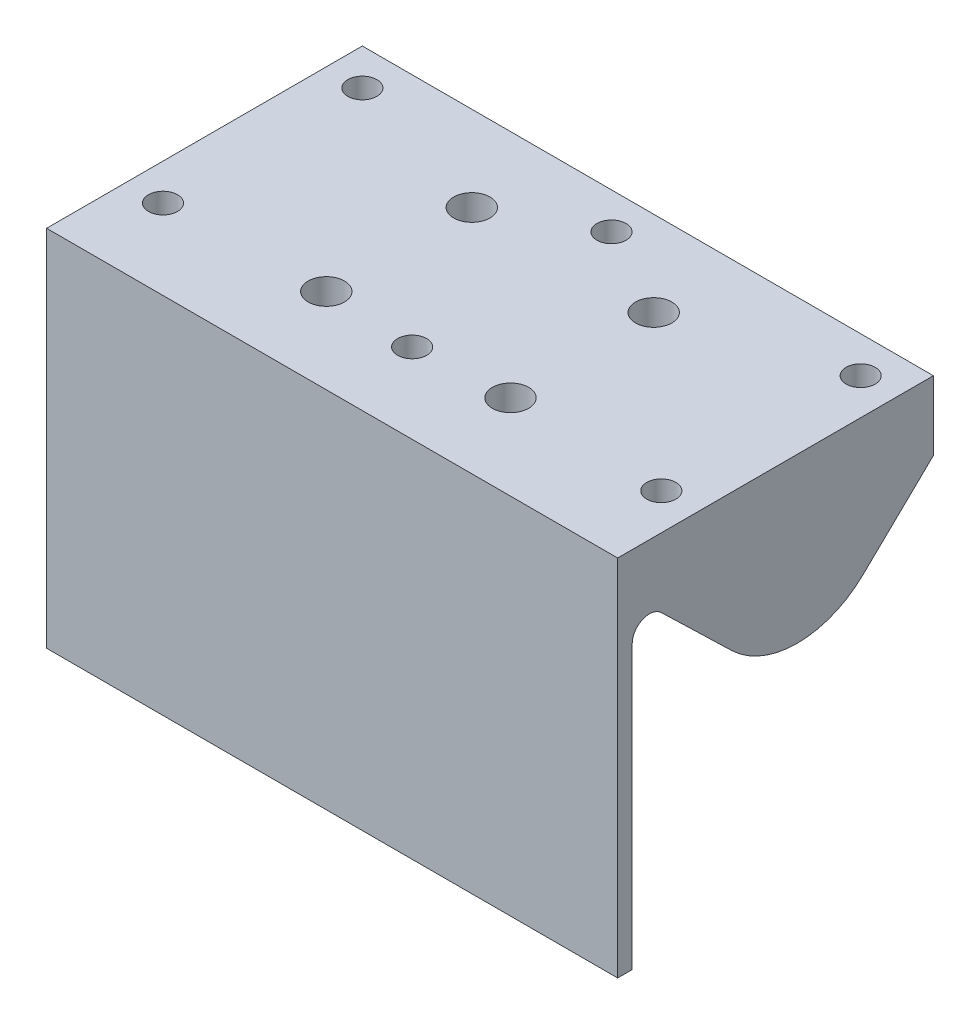
from build123d import *

# Parameters (mm, degrees)
SKETCH1_W           = 78.5
SKETCH1_H           = 37.4
BOSS_EXTRUDE1_DEPTH = 9.5
SKETCH6_R           = 2
CUT_EXTRUDE1_DEPTH  = 6.5
BOSS_EXTRUDE2_DEPTH = 4
SKETCH9_W           = 13
SKETCH9_H           = 5.5
CUT_EXTRUDE3_DEPTH  = 56.75233179
BOSS_EXTRUDE3_REACH = 83.737
BOSS_EXTRUDE4_START = -4
BOSS_EXTRUDE4_DEPTH = 4
BOSS_EXTRUDE5_DEPTH = 4
SKETCH15_R          = 2.5
CUT_EXTRUDE4_DEPTH  = 15
SKETCH16_R          = 4
CUT_EXTRUDE5_DEPTH  = 3


with BuildPart() as part:
    # Sketch1 → Boss-Extrude1 (new body)
    with BuildSketch(Plane(origin=(0, 0, 0), x_dir=(1, 0, 0), z_dir=(0, 1, 0))):
        Rectangle(SKETCH1_W, SKETCH1_H)
    extrude(amount=BOSS_EXTRUDE1_DEPTH)

    # Sketch6 → Cut-Extrude1 (cut)
    with BuildSketch(Plane(origin=(0, 9.5, 0), x_dir=(1, 0, 0), z_dir=(0, 1, 0))):
        with Locations(Location((-34.25, 13.7, 0), (0, 0, 270))):
            Circle(SKETCH6_R)
        with Locations(Location((0, 13.7, 0), (0, 0, 270))):
            Circle(SKETCH6_R)
        with Locations(Location((34.25, 13.7, 0), (0, 0, 270))):
            Circle(SKETCH6_R)
        with Locations(Location((34.25, -13.7, 0), (0, 0, 270))):
            Circle(SKETCH6_R)
        with Locations(Location((0, -13.7, 0), (0, 0, 270))):
            Circle(SKETCH6_R)
        with Locations(Location((-34.25, -13.7, 0), (0, 0, 270))):
            Circle(SKETCH6_R)
    extrude(amount=-CUT_EXTRUDE1_DEPTH, mode=Mode.SUBTRACT)

    # Sketch7 → Boss-Extrude2 (add)
    with BuildSketch(Plane.ZY.offset(39.25)):
        with BuildLine():
            Line((-18.7, 0), (-9.037433155, -9.344774046))
            ThreePointArc((-9.037433155, -9.344774046), (0, -13), (9.037433155, -9.344774046))
            Line((9.037433155, -9.344774046), (18.7, 0))
            Line((18.7, 0), (-18.7, 0))
        make_face()
    boss_extrude2 = extrude(amount=-BOSS_EXTRUDE2_DEPTH)

    # Mirror1: Boss-Extrude2 across plane
    add(boss_extrude2.mirror(Plane(origin=(0, 0, 0), x_dir=(0, 0, 1), z_dir=(1, 0, 0))))

    # Sketch9 → Cut-Extrude3 (cut, through all)
    with BuildSketch(Plane(origin=(0, 0, -18.7), x_dir=(-1, 0, 0), z_dir=(0, 0, -1))):
        with Locations((24.75, 4.75)):
            Rectangle(SKETCH9_W, SKETCH9_H)
        with Locations((-24.75, 4.75)):
            Rectangle(SKETCH9_W, SKETCH9_H)
    extrude(amount=-CUT_EXTRUDE3_DEPTH, mode=Mode.SUBTRACT)

    # Boss-Extrude3: up to this face of the body (flat: up to its plane)
    boss_extrude3_end = Plane(part.part.faces().sort_by_distance((39.25, 0.189608499, 0))[0])
    # Sketch11 → Boss-Extrude3 (add, up to the picked face)
    with BuildSketch(Plane.ZY.offset(39.25), mode=Mode.PRIVATE) as boss_extrude3_sk1:
        with BuildLine():
            Line((18.7, 9.5), (24.7, 9.5))
            Line((24.7, 9.5), (24.7, -40.5))
            Line((24.7, -40.5), (22.7, -40.5))
            Line((22.7, -40.5), (22.7, 3.5))
            ThreePointArc((22.7, 3.5), (21.528427125, 6.328427125), (18.7, 7.5))
            Line((18.7, 7.5), (18.7, 9.5))
        make_face()
    boss_extrude3_tool1 = split(extrude(boss_extrude3_sk1.sketch, amount=-BOSS_EXTRUDE3_REACH, mode=Mode.PRIVATE), bisect_by=boss_extrude3_end, keep=Keep.BOTH, mode=Mode.PRIVATE)
    add(boss_extrude3_tool1.solids().sort_by(Axis((-39.25, -13.095828, 23.426281), (1, 0, 0)))[0])

    # Sketch12 → Boss-Extrude4 (add)
    with BuildSketch(Plane(origin=(39.25, 0, 0), x_dir=(0, 0, -1), z_dir=(1, 0, 0)).offset(BOSS_EXTRUDE4_START)):
        with BuildLine():
            Line((-18.7, 7.5), (-18.7, 0))
            ThreePointArc((-18.7, 0), (-21.261557408, 0.476218058), (-22.7, -1.696163792))
            Line((-22.7, -1.696163792), (-22.7, 3.5))
            ThreePointArc((-22.7, 3.5), (-21.528427125, 6.328427125), (-18.7, 7.5))
        make_face()
    extrude(amount=BOSS_EXTRUDE4_DEPTH)

    # Sketch13 → Boss-Extrude5 (add)
    with BuildSketch(Plane.ZY.offset(39.25)):
        with BuildLine():
            Line((22.7, -1.696163792), (22.7, 3.5))
            ThreePointArc((22.7, 3.5), (21.528427125, 6.328427125), (18.7, 7.5))
            Line((18.7, 7.5), (18.7, 0))
            ThreePointArc((18.7, 0), (21.261557408, 0.476218058), (22.7, -1.696163792))
        make_face()
    extrude(amount=-BOSS_EXTRUDE5_DEPTH)

    # Sketch15 → Cut-Extrude4 (cut)
    with BuildSketch(Plane(origin=(0, 9.5, 0), x_dir=(1, 0, 0), z_dir=(0, 1, 0))):
        with Locations(Location((-12.5, 7, 0), (0, 0, 270))):
            Circle(SKETCH15_R)
        with Locations(Location((-12.5, -13, 0), (0, 0, 270))):
            Circle(SKETCH15_R)
        with Locations(Location((12.816690271, -13, 0), (0, 0, 270))):
            Circle(SKETCH15_R)
        with Locations(Location((12.5, 7, 0), (0, 0, 270))):
            Circle(SKETCH15_R)
    extrude(amount=-CUT_EXTRUDE4_DEPTH, mode=Mode.SUBTRACT)

    # Sketch16 → Cut-Extrude5 (cut)
    with BuildSketch(Plane.XZ):
        with Locations(Location((-12.5, 13, 0), (0, 0, 270))):
            Circle(SKETCH16_R)
        with Locations(Location((12.816690271, 13, 0), (0, 0, 270))):
            Circle(SKETCH16_R)
        with Locations(Location((12.5, -7, 0), (0, 0, 270))):
            Circle(SKETCH16_R)
        with Locations(Location((-12.5, -7, 0), (0, 0, 270))):
            Circle(SKETCH16_R)
    extrude(amount=-CUT_EXTRUDE5_DEPTH, mode=Mode.SUBTRACT)


solid = part.part
